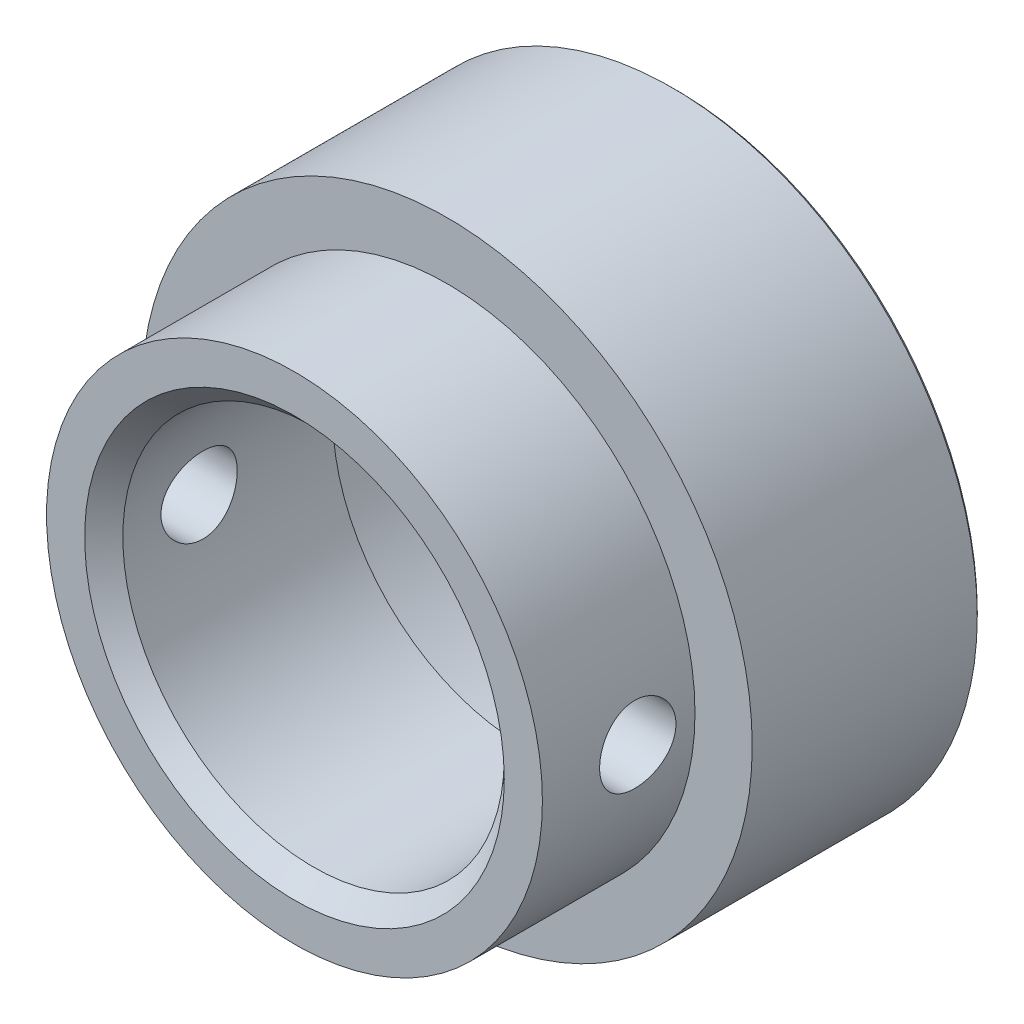
from build123d import *

# Parameters (mm, degrees)
SKETCH_1_R               = 80
EXTRUDE_1_DEPTH          = 60
SKETCH_2_R               = 65
EXTRUDE_2_DEPTH          = 40
SKETCH_3_R               = 70
CUT_EXTRUDE_1_DEPTH      = 40
SKETCH_4_R               = 50
CUT_EXTRUDE_2_DEPTH      = 151.996688705
CHAMFER_1_SIZE           = 1
CUT_EXTRUDE_3_DEPTH      = 151.996688705
CUT_EXTRUDE_3_DEPTH_BACK = 151.996688705
SKETCH_5_R               = 10
CHAMFER_2_SIZE           = 5


with BuildPart() as part:
    # Эскиз1 → Бобышка-Вытянуть1 (new body)
    with BuildSketch(Plane.XY):
        Circle(SKETCH_1_R)
    extrude(amount=EXTRUDE_1_DEPTH)

    # Эскиз2 → Бобышка-Вытянуть2 (add)
    with BuildSketch(Plane.XY.offset(60)):
        Circle(SKETCH_2_R)
    extrude(amount=EXTRUDE_2_DEPTH)

    # Эскиз3 → Вырез-Вытянуть1 (cut)
    with BuildSketch(Plane(origin=(0, 0, 0), x_dir=(-1, 0, 0), z_dir=(0, 0, -1))):
        Circle(SKETCH_3_R)
    extrude(amount=-CUT_EXTRUDE_1_DEPTH, mode=Mode.SUBTRACT)

    # Эскиз4 → Вырез-Вытянуть2 (cut, through all)
    with BuildSketch(Plane.XY.offset(100)):
        Circle(SKETCH_4_R)
    extrude(amount=-CUT_EXTRUDE_2_DEPTH, mode=Mode.SUBTRACT)

    # Фаска1
    chamfer_1_edges = [part.edges().sort_by_distance(p)[0] for p in [
        (70, 0, 0),
        (-80, 0, 0),
    ]]
    chamfer(chamfer_1_edges, length=CHAMFER_1_SIZE)

    # Эскиз5 → Вырез-Вытянуть3 (cut, two sides: drawn at the far end of the back side and taken through both)
    with BuildSketch(Plane(origin=(0, 0, 0), x_dir=(0, 0, -1), z_dir=(1, 0, 0)).offset(-CUT_EXTRUDE_3_DEPTH_BACK)):
        with Locations((-75, 0)):
            Circle(SKETCH_5_R)
    extrude(amount=CUT_EXTRUDE_3_DEPTH + CUT_EXTRUDE_3_DEPTH_BACK, mode=Mode.SUBTRACT)

    # Фаска2
    chamfer_2_edges = [part.edges().sort_by_distance(p)[0] for p in [
        (-50, 0, 100),
    ]]
    chamfer(chamfer_2_edges, length=CHAMFER_2_SIZE)


solid = part.part
